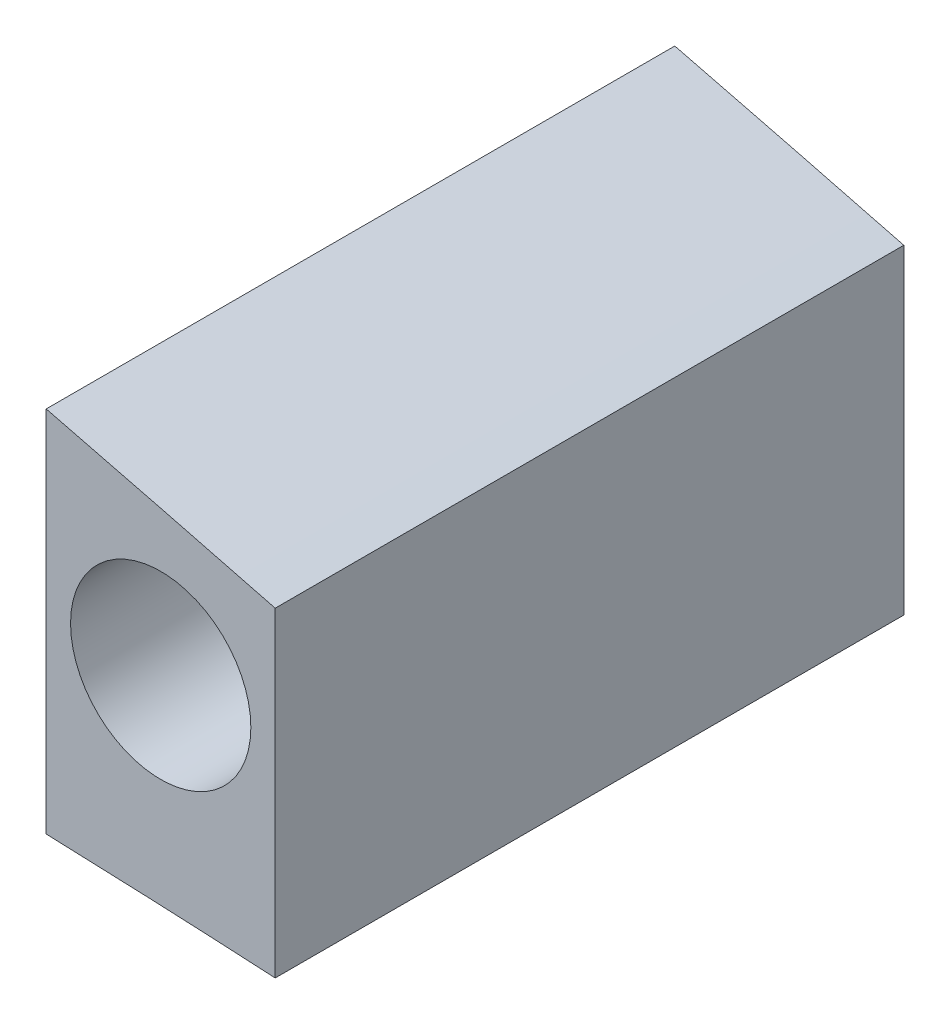
from build123d import *

# Parameters (mm, degrees)
BOSS_EXTRUDE1_DEPTH = 34.8615
SKETCH2_R           = 6.35
SKETCH2_R_2         = 5
SKETCH2_W           = 138.882076439
SKETCH2_H           = 152.274276667
CUT_EXTRUDE1_DEPTH  = 318.646799811
SKETCH3_W           = 293.18888876
SKETCH3_H           = 137.971241769
CUT_EXTRUDE2_DEPTH  = 242.109386719


with BuildPart() as part:
    # Sketch1 → Boss-Extrude1 (new body)
    with BuildSketch(Plane.XY):
        with BuildLine():
            add(Edge.make_bspline(
                [(0.000560351, 0.000130087), (0.810633127, 7.359196055), (8.649092025, 17.856605174), (26.286719818, 29.975176328), (52.111128271, 42.069215275), (89.597618475, 49.290763054), (131.400792109, 47.884831915), (173.256699242, 40.041104278), (217.961060472, 29.612974894), (256.952064401, 19.528920948), (290.35983767, 8.71099439), (301.273197721, 4.382828139), (314.816918223, -0.516206742), (309.846313895, 0.000130087)],
                knots=[0, 0, 0, 0, 0.060863618, 0.113688265, 0.188608742, 0.312908923, 0.448482434, 0.557612135, 0.691544113, 0.852438279, 0.92975597, 0.976058229, 1, 1, 1, 1], degree=3))
            add(Edge.make_bspline(
                [(309.846313895, 0.000130087), (303.956832565, 1.47095521), (293.989507544, 2.093987313), (276.26402299, 4.514356704), (260.846344817, 5.427413394), (235.858814759, 7.870306192), (205.101424636, 8.838080282), (157.718638092, 9.030650149), (110.497331172, 6.181495223), (66.506197185, -0.586669107), (36.454672816, -6.098499901), (15.316603331, -6.189065841), (1.230714189, -6.924076091), (0.000560351, 0.000130087)],
                knots=[0, 0, 0, 0, 0.057787081, 0.095274891, 0.171021118, 0.205339302, 0.335319146, 0.464904334, 0.658702312, 0.785511947, 0.893517288, 0.94309214, 1, 1, 1, 1], degree=3))
        make_face()
    extrude(amount=BOSS_EXTRUDE1_DEPTH)

    # Sketch2 → Cut-Extrude1 (cut, through all)
    with BuildSketch(Plane.XY.offset(34.8615)):
        with Locations((20.32, 10.16)):
            Circle(SKETCH2_R)
        with Locations((227.296313895, 19.050130087)):
            Circle(SKETCH2_R_2)
        with Locations((303.087352115, 19.854149729)):
            Rectangle(SKETCH2_W, SKETCH2_H)
    extrude(amount=-CUT_EXTRUDE1_DEPTH, mode=Mode.SUBTRACT)

    # Sketch3 → Cut-Extrude2 (cut, through all)
    with BuildSketch(Plane.XY.offset(34.8615)):
        with Locations((74.351869515, 19.480058122)):
            Rectangle(SKETCH3_W, SKETCH3_H)
    extrude(amount=-CUT_EXTRUDE2_DEPTH, mode=Mode.SUBTRACT)


solid = part.part
